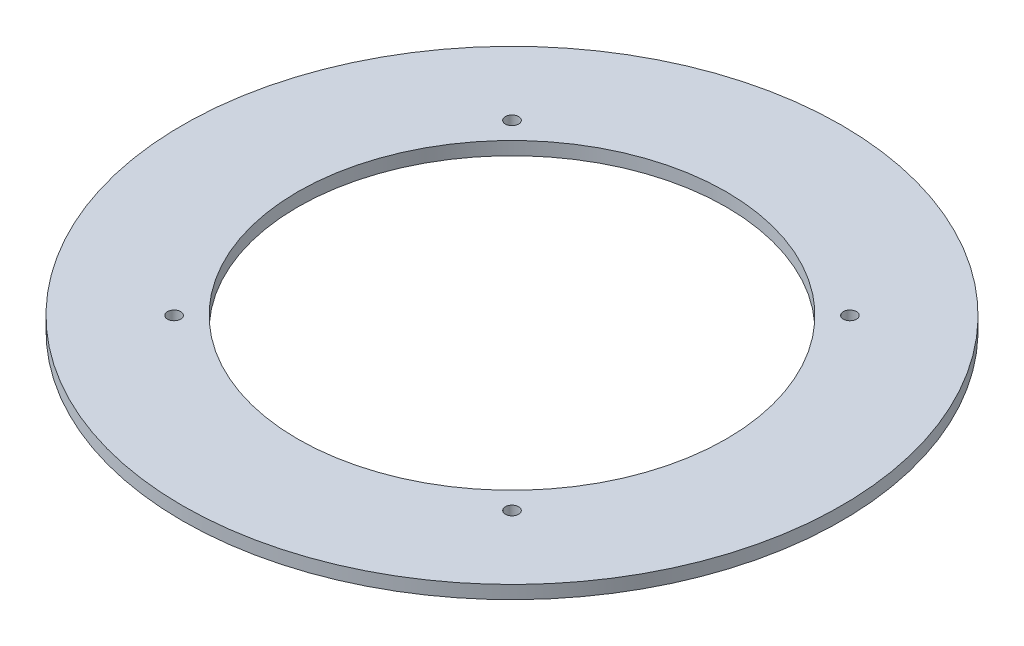
from build123d import *

# Parameters (mm, degrees)
SKETCH2_R           = 100
SKETCH2_R_2         = 65
BOSS_EXTRUDE1_DEPTH = 4
SKETCH5_R           = 2
CUT_EXTRUDE1_DEPTH  = 142.477913471


with BuildPart() as part:
    # Sketch2 → Boss-Extrude1 (new body)
    with BuildSketch(Plane(origin=(0, 0, 0), x_dir=(1, 0, 0), z_dir=(0, 1, 0))):
        with Locations(Location((0, 0, 0), (0, 0, 270))):
            Circle(SKETCH2_R)
        with Locations(Location((0, 0, 0), (0, 0, 270))):
            Circle(SKETCH2_R_2, mode=Mode.SUBTRACT)
    extrude(amount=BOSS_EXTRUDE1_DEPTH)

    # Sketch5 → Cut-Extrude1 (cut, through all)
    with BuildSketch(Plane.XZ):
        with Locations(Location((-51.265241636, 51.265241636, 0), (0, 0, 270))):
            Circle(SKETCH5_R)
        with Locations(Location((51.265241636, -51.265241636, 0), (0, 0, 90))):
            Circle(SKETCH5_R)
        with Locations(Location((-51.265241636, -51.265241636, 0), (0, 0, 270))):
            Circle(SKETCH5_R)
        with Locations(Location((51.265241636, 51.265241636, 0), (0, 0, 90))):
            Circle(SKETCH5_R)
    extrude(amount=-CUT_EXTRUDE1_DEPTH, mode=Mode.SUBTRACT)


solid = part.part
